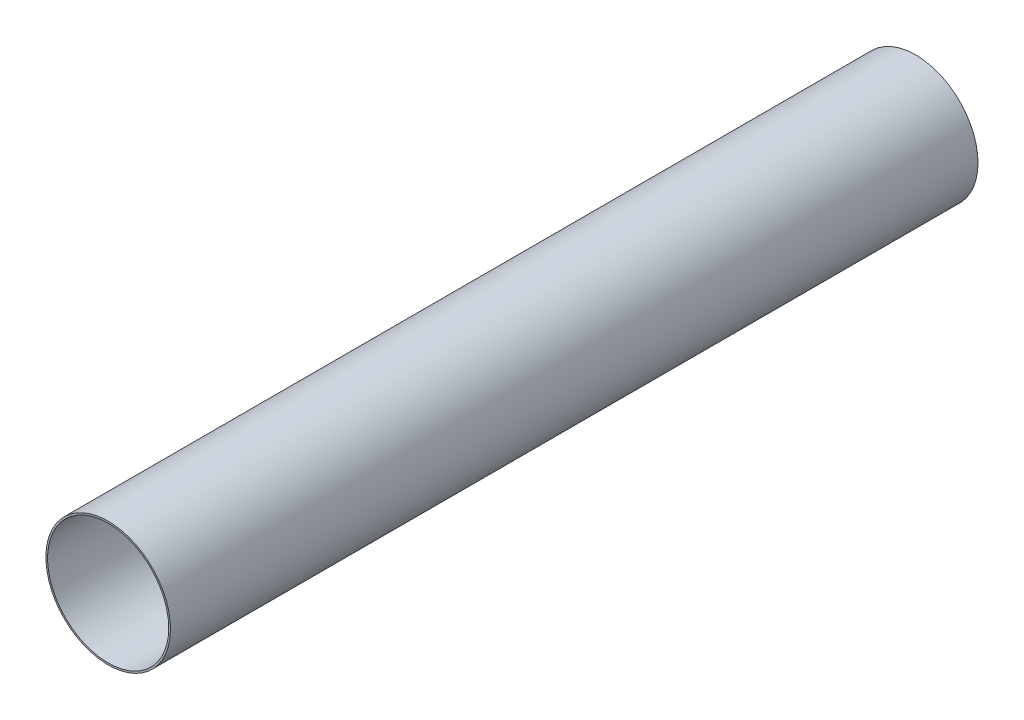
from build123d import *

# Parameters (mm, degrees)
ESQUISSE2_R        = 78.359
ESQUISSE2_R_2      = 76.2
BOSS_EXTRU_1_DEPTH = 1016


with BuildPart() as part:
    # Esquisse2 → Boss.-Extru.1 (new body)
    with BuildSketch(Plane.XY):
        Circle(ESQUISSE2_R)
        Circle(ESQUISSE2_R_2, mode=Mode.SUBTRACT)
    extrude(amount=BOSS_EXTRU_1_DEPTH)


solid = part.part
